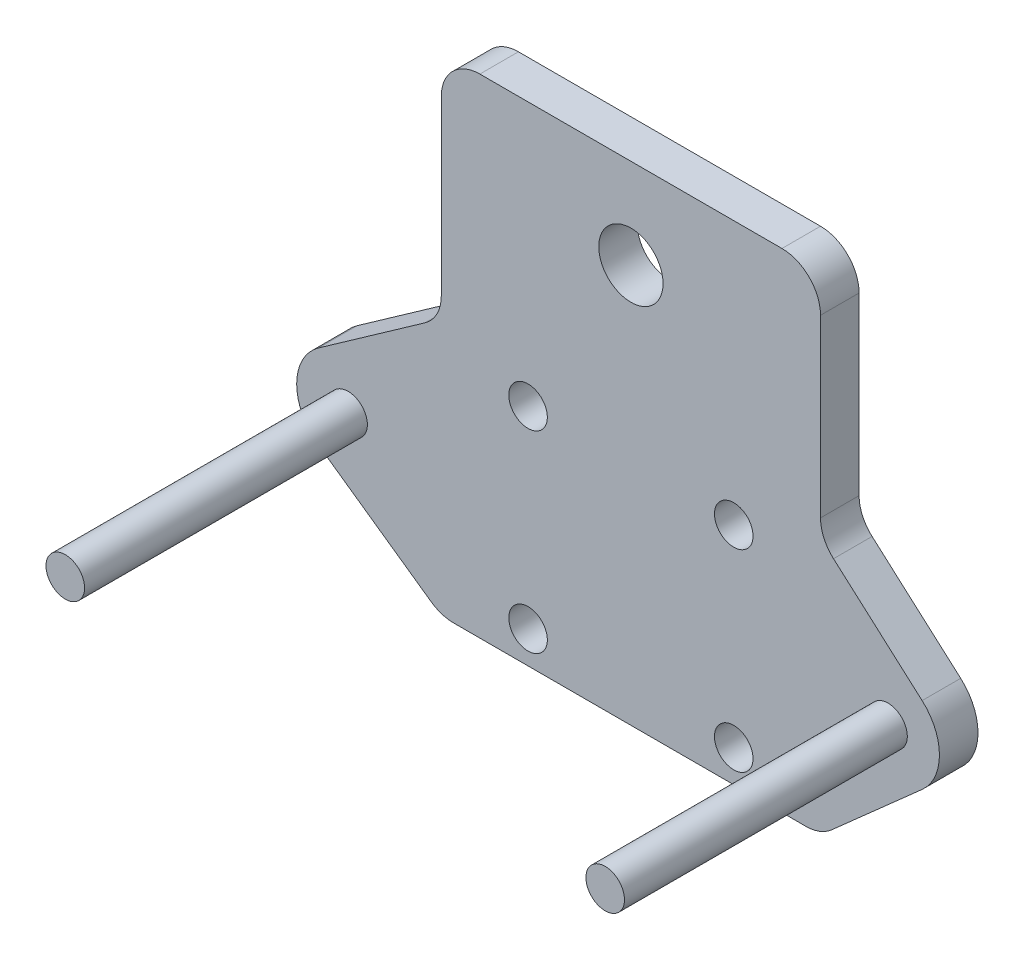
from build123d import *

# Parameters (mm, degrees)
SKETCH2_W             = 29.5
SKETCH2_H             = 38
SKETCH2_R             = 1.5
SKETCH2_R_2           = 2.5
BOSS_EXTRUDE1_DEPTH   = 1.5
SKETCH3_R             = 1.5
BOSS_EXTRUDE2_DEPTH   = 3
FILLET2_R             = 3
SKETCH4_R             = 1.5
BOSS_EXTRUDE3_DEPTH   = 25
BOSS_EXTRUDE3_2_DEPTH = 25


with BuildPart() as part:
    # Sketch2 → Boss-Extrude1 (new, symmetric)
    with BuildSketch(Plane.XY):
        with Locations((0, -12)):
            Rectangle(SKETCH2_W, SKETCH2_H)
        with Locations((-8, -13.5)):
            Circle(SKETCH2_R, mode=Mode.SUBTRACT)
        with Locations((8, -13.5)):
            Circle(SKETCH2_R, mode=Mode.SUBTRACT)
        with Locations((8, -28.5)):
            Circle(SKETCH2_R, mode=Mode.SUBTRACT)
        with Locations((-8, -28.5)):
            Circle(SKETCH2_R, mode=Mode.SUBTRACT)
        Circle(SKETCH2_R_2, mode=Mode.SUBTRACT)
    extrude(amount=BOSS_EXTRUDE1_DEPTH, both=True)

    # Sketch3 → Boss-Extrude2 (add)
    # profile 1 of 2: a face of its own
    with BuildSketch(Plane.XY.offset(1.5)):
        with BuildLine():
            Line((-24.303579423, -24.270095082), (-14.75, -31))
            Line((-14.75, -31), (-14.75, -11))
            Line((-14.75, -11), (-24.303579423, -17.729904918))
            ThreePointArc((-24.303579423, -17.729904918), (-26, -21), (-24.303579423, -24.270095082))
        make_face()
        with Locations((-22, -21)):
            Circle(SKETCH3_R, mode=Mode.SUBTRACT)
    # profile 2 of 2: a face of its own
    with BuildSketch(Plane.XY.offset(1.5)):
        with BuildLine():
            Line((22.653543192, -23.993110176), (14.75, -31))
            Line((14.75, -31), (14.75, -11))
            Line((14.75, -11), (22.653543192, -18.006889824))
            ThreePointArc((22.653543192, -18.006889824), (24, -21), (22.653543192, -23.993110176))
        make_face()
        with Locations((20, -21)):
            Circle(SKETCH3_R, mode=Mode.SUBTRACT)
    extrude(amount=-BOSS_EXTRUDE2_DEPTH)

    # Fillet2
    fillet2_edges = [part.edges().sort_by_distance(p)[0] for p in [
        (-14.75, -11, 0),
        (14.75, -11, 0),
        (-14.75, 7, 0),
        (14.75, 7, 0),
        (14.75, -31, 0),
        (-14.75, -31, 0),
    ]]
    fillet(fillet2_edges, radius=FILLET2_R)


with BuildPart() as body_2:
    # Sketch4 → Boss-Extrude3 (new body)
    with BuildSketch(Plane(origin=(0, 0, -1.5), x_dir=(-1, 0, 0), z_dir=(0, 0, -1))):
        with Locations((22, -21)):
            Circle(SKETCH4_R)
    extrude(amount=-BOSS_EXTRUDE3_DEPTH)


with BuildPart() as body_3:
    # Sketch4 → Boss-Extrude3 2 (new body)
    with BuildSketch(Plane(origin=(0, 0, -1.5), x_dir=(-1, 0, 0), z_dir=(0, 0, -1))):
        with Locations((-20, -21)):
            Circle(SKETCH4_R)
    extrude(amount=-BOSS_EXTRUDE3_2_DEPTH)


solid = Compound([part.part, body_2.part, body_3.part])
